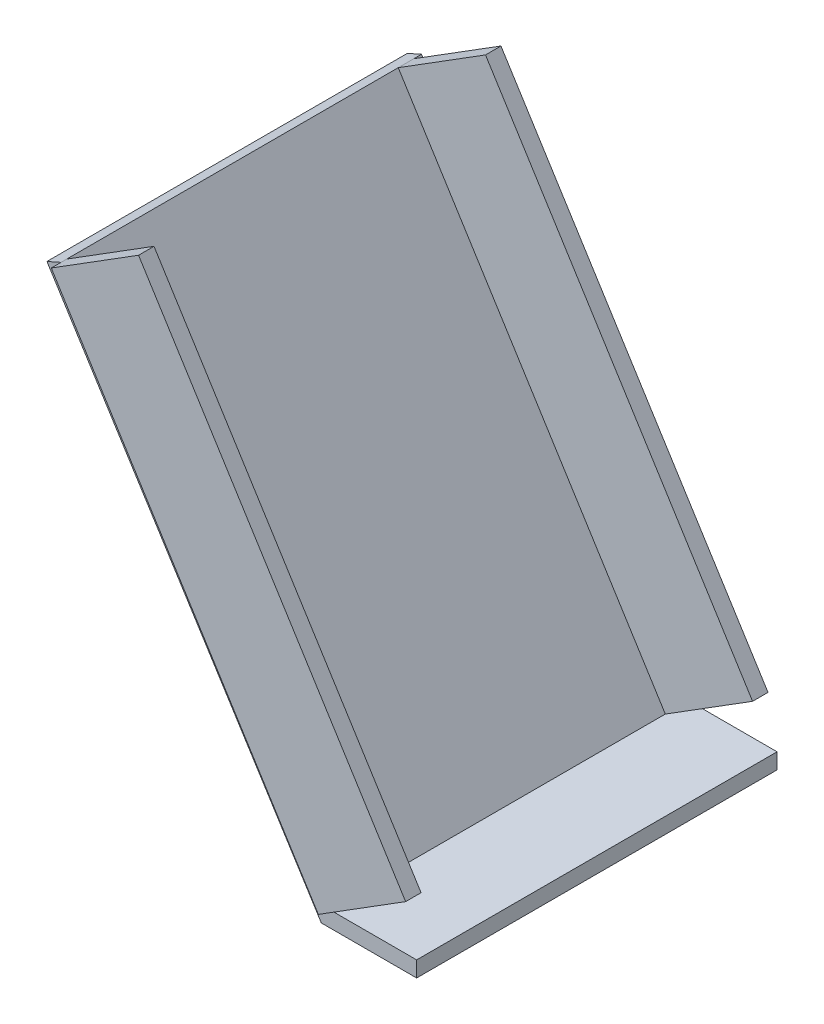
from build123d import *

# Parameters (mm, degrees)
BOSS_EXTRUDE1_DEPTH = 35
SKETCH3_W           = 3
SKETCH3_H           = 97.69244928
EXTRUDE_THIN1_DEPTH = 20


with BuildPart() as part:
    # Sketch1 → Boss-Extrude1 (new, symmetric)
    with BuildSketch(Plane.XY):
        Polygon((-26.646058096, 42.308244917), (26.646058096, -42.308244917), (45.155915247, -42.308244917), (45.155915247, -39.259184306), (27.963657577, -39.259184306), (-23.904623451, 43.526660315), align=None)
    extrude(amount=BOSS_EXTRUDE1_DEPTH, both=True)

    # Sketch3 → Extrude-Thin1 (add)
    with BuildSketch(Plane(origin=(2.417426631, 1.514603909, 0), x_dir=(0, 0, -1), z_dir=(0.8474129293595072, 0.5309343906306494, 0))):
        with Locations((-35.395786922, 0.730616768)):
            Rectangle(SKETCH3_W, SKETCH3_H)
        with Locations((31.987403947, 0.730616768)):
            Rectangle(SKETCH3_W, SKETCH3_H)
    extrude(amount=EXTRUDE_THIN1_DEPTH)


solid = part.part
